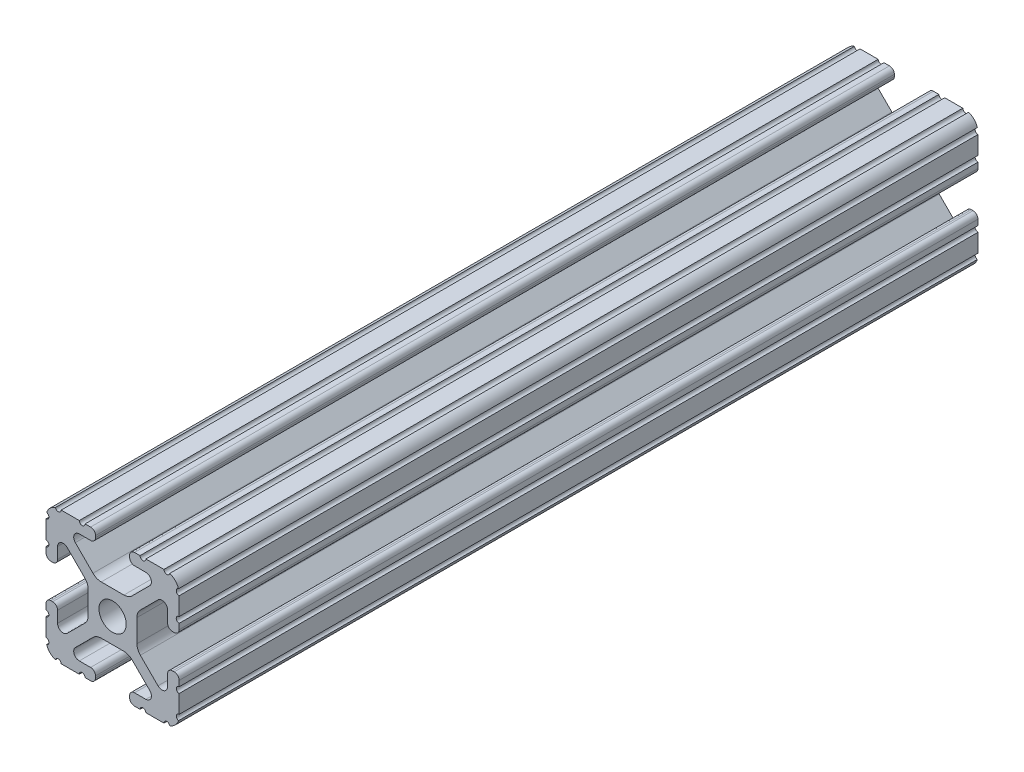
from build123d import *

# Parameters (mm, degrees)
BOSS_EXTRUDE1_DEPTH     = 76.2
CUT_EXTRUDE1_DEPTH      = 79.288057838
CUT_EXTRUDE1_DEPTH_BACK = 79.288057838
SKETCH5_R               = 0.55245


with BuildPart() as part:
    # Sketch4 → Boss-Extrude1 (new, symmetric)
    with BuildSketch(Plane.XY):
        with BuildLine():
            Line((4.190365, -12.7), (10.11729625, -12.7))
            ThreePointArc((10.11729625, -12.7), (11.943543585, -11.943543585), (12.7, -10.11729625))
            Line((12.7, -10.11729625), (12.7, -4.190365))
            ThreePointArc((12.7, -4.190365), (12.42492494, -3.52627506), (11.760835, -3.2512))
            Line((11.760835, -3.2512), (11.429365, -3.2512))
            ThreePointArc((11.429365, -3.2512), (10.76527506, -3.52627506), (10.4902, -4.190365))
            Line((10.4902, -4.190365), (10.4902, -6.348478019))
            ThreePointArc((10.4902, -6.348478019), (9.830707141, -7.335478831), (8.666460301, -7.103895736))
            Line((8.666460301, -7.103895736), (5.299899128, -3.737334563))
            ThreePointArc((5.299899128, -3.737334563), (4.817571085, -3.015479634), (4.6482, -2.16399369))
            Line((4.6482, -2.16399369), (4.6482, 0))
            Line((4.6482, 0), (2.6035, 0))
            ThreePointArc((2.6035, 0), (1.840952505, -1.840952505), (0, -2.6035))
            Line((0, -2.6035), (0, -4.6482))
            Line((0, -4.6482), (2.16399369, -4.6482))
            ThreePointArc((2.16399369, -4.6482), (3.015479634, -4.817571085), (3.737334563, -5.299899128))
            Line((3.737334563, -5.299899128), (7.103895736, -8.666460301))
            ThreePointArc((7.103895736, -8.666460301), (7.335478831, -9.830707141), (6.348478019, -10.4902))
            Line((6.348478019, -10.4902), (4.190365, -10.4902))
            ThreePointArc((4.190365, -10.4902), (3.52627506, -10.76527506), (3.2512, -11.429365))
            Line((3.2512, -11.429365), (3.2512, -11.760835))
            ThreePointArc((3.2512, -11.760835), (3.52627506, -12.42492494), (4.190365, -12.7))
        make_face()
    extrude(amount=BOSS_EXTRUDE1_DEPTH, both=True)

    # Sketch5 → Cut-Extrude1 (cut, two sides: drawn at the far end of the back side and taken through both)
    with BuildSketch(Plane.XY.offset(-CUT_EXTRUDE1_DEPTH_BACK)):
        with Locations((10.356153152, -12.7)):
            Circle(SKETCH5_R)
        with Locations((5.796028019, -12.7)):
            Circle(SKETCH5_R)
        with Locations((12.7, -10.356153152)):
            Circle(SKETCH5_R)
        with Locations((12.7, -5.796028019)):
            Circle(SKETCH5_R)
    extrude(amount=CUT_EXTRUDE1_DEPTH + CUT_EXTRUDE1_DEPTH_BACK, mode=Mode.SUBTRACT)

    # Mirror1: part across plane


with BuildPart() as part_1:
    add(part.part)
    add(part.part.mirror(Plane(origin=(0, 0, 0), x_dir=(0, 0, 1), z_dir=(1, 0, 0))))

    # Mirror2: part across plane


with BuildPart() as part_2:
    add(part_1.part)
    add(part_1.part.mirror(Plane.ZX))


solid = part_2.part
